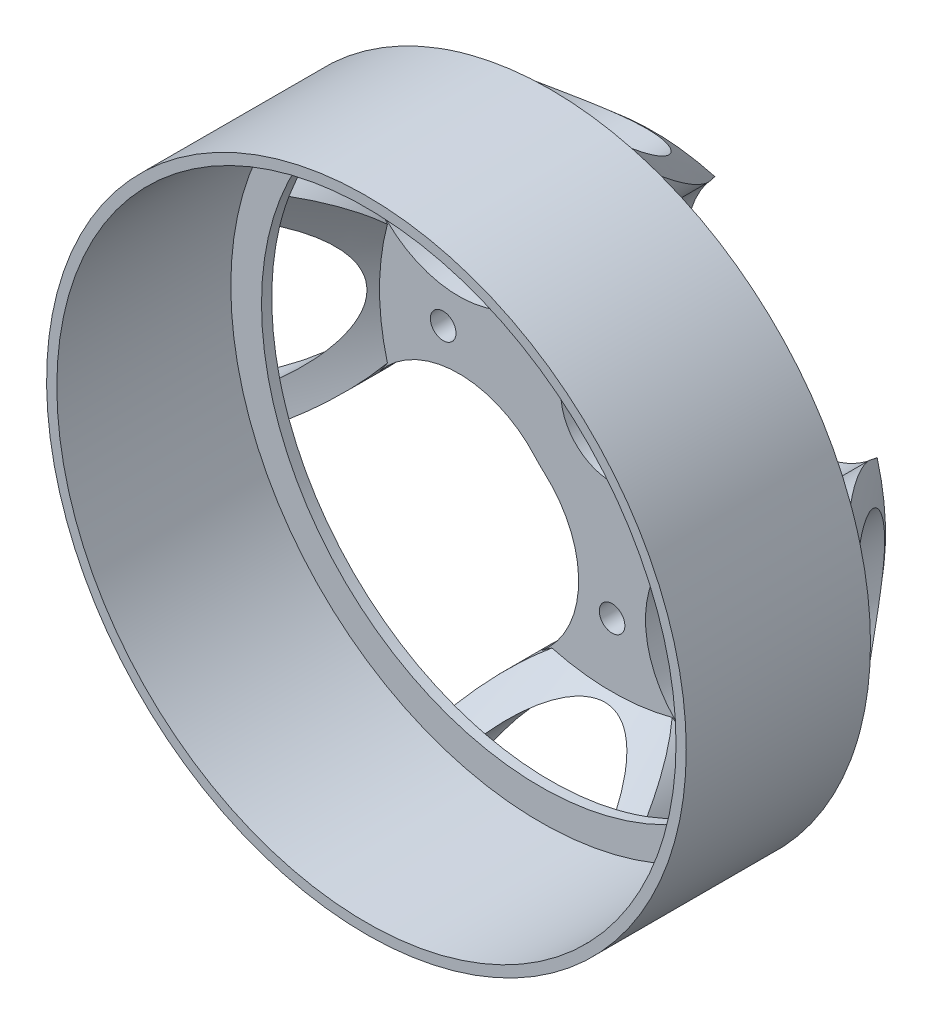
from build123d import *

# Parameters (mm, degrees)
SKETCH1_R             = 31.25
SKETCH1_R_2           = 30.25
BOSS_EXTRUDE1_DEPTH   = 17
BOSS_EXTRUDE2_START   = 1
SKETCH2_R             = 31.25
SKETCH2_R_2           = 27.25
BOSS_EXTRUDE2_DEPTH   = 1
SKETCH4_R             = 5
BOSS_EXTRUDE4_DEPTH   = 4
BOSS_EXTRUDE5_DEPTH   = 10
M3X0_5_TAPPED_HOLE1_D = 2.5


with BuildPart() as part:
    # Sketch1 → Boss-Extrude1 (new body)
    with BuildSketch(Plane.XY):
        Circle(SKETCH1_R)
        Circle(SKETCH1_R_2, mode=Mode.SUBTRACT)
    extrude(amount=BOSS_EXTRUDE1_DEPTH)

    # Sketch2 → Boss-Extrude2 (add)
    with BuildSketch(Plane(origin=(0, 0, 0), x_dir=(-1, 0, 0), z_dir=(0, 0, -1)).offset(BOSS_EXTRUDE2_START)):
        Circle(SKETCH2_R)
        Circle(SKETCH2_R_2, mode=Mode.SUBTRACT)
    extrude(amount=-BOSS_EXTRUDE2_DEPTH)



with BuildPart() as body_2:
    # Sketch4 → Boss-Extrude4 (new body)
    with BuildSketch(Plane(origin=(0, 0, -11), x_dir=(-1, 0, 0), z_dir=(0, 0, -1))):
        with BuildLine():
            ThreePointArc((6.631912224, -7.4845), (7.071067812, -7.071067812), (7.4845, -6.631912224))
            ThreePointArc((7.4845, -6.631912224), (15.176212796, -3.265971536), (22.721857143, -6.947717568))
            ThreePointArc((22.721857143, -6.947717568), (20.25, 0), (22.721857143, 6.947717568))
            ThreePointArc((22.721857143, 6.947717568), (15.176212796, 3.265971536), (7.4845, 6.631912224))
            ThreePointArc((7.4845, 6.631912224), (7.071067812, 7.071067812), (6.631912224, 7.4845))
            ThreePointArc((6.631912224, 7.4845), (3.265971536, 15.176212796), (6.947717568, 22.721857143))
            ThreePointArc((6.947717568, 22.721857143), (0, 20.25), (-6.947717568, 22.721857143))
            ThreePointArc((-6.947717568, 22.721857143), (-3.265971536, 15.176212796), (-6.631912224, 7.4845))
            ThreePointArc((-6.631912224, 7.4845), (-7.071067812, 7.071067812), (-7.4845, 6.631912224))
            ThreePointArc((-7.4845, 6.631912224), (-15.176212796, 3.265971536), (-22.721857143, 6.947717568))
            ThreePointArc((-22.721857143, 6.947717568), (-20.25, 0), (-22.721857143, -6.947717568))
            ThreePointArc((-22.721857143, -6.947717568), (-15.176212796, -3.265971536), (-7.4845, -6.631912224))
            ThreePointArc((-7.4845, -6.631912224), (-7.071067812, -7.071067812), (-6.631912224, -7.4845))
            ThreePointArc((-6.631912224, -7.4845), (-3.265971536, -15.176212796), (-6.947717568, -22.721857143))
            ThreePointArc((-6.947717568, -22.721857143), (0, -20.25), (6.947717568, -22.721857143))
            ThreePointArc((6.947717568, -22.721857143), (3.265971536, -15.176212796), (6.631912224, -7.4845))
        make_face()
        Circle(SKETCH4_R, mode=Mode.SUBTRACT)
    extrude(amount=-BOSS_EXTRUDE4_DEPTH)


with BuildPart() as part_1:
    add(part.part)

    add(body_2.part)  # Boss-Extrude5 merges body 2
    # Sketch4<10> → Boss-Extrude5 (add)
    with BuildSketch(Plane(origin=(0, 0, -11), x_dir=(-1, 0, 0), z_dir=(0, 0, -1))):
        with BuildLine():
            ThreePointArc((29.314, 10.828291832), (20.25, 0), (29.314, -10.828291832))
            ThreePointArc((29.314, -10.828291832), (29.805148071, -9.392318589), (30.226, -7.934193343))
            ThreePointArc((30.226, -7.934193343), (23.25, 0), (30.226, 7.934193343))
            ThreePointArc((30.226, 7.934193343), (29.805148071, 9.392318589), (29.314, 10.828291832))
        make_face()
        with BuildLine():
            ThreePointArc((-10.828291832, 29.314), (0, 20.25), (10.828291832, 29.314))
            ThreePointArc((10.828291832, 29.314), (9.392318589, 29.805148071), (7.934193343, 30.226))
            ThreePointArc((7.934193343, 30.226), (0, 23.25), (-7.934193343, 30.226))
            ThreePointArc((-7.934193343, 30.226), (-9.392318589, 29.805148071), (-10.828291832, 29.314))
        make_face()
        with BuildLine():
            ThreePointArc((10.828291832, -29.314), (0, -20.25), (-10.828291832, -29.314))
            ThreePointArc((-10.828291832, -29.314), (-9.392318589, -29.805148071), (-7.934193343, -30.226))
            ThreePointArc((-7.934193343, -30.226), (0, -23.25), (7.934193343, -30.226))
            ThreePointArc((7.934193343, -30.226), (9.392318589, -29.805148071), (10.828291832, -29.314))
        make_face()
        with BuildLine():
            ThreePointArc((-29.314, -10.828291832), (-20.25, 0), (-29.314, 10.828291832))
            ThreePointArc((-29.314, 10.828291832), (-29.805148071, 9.392318589), (-30.226, 7.934193343))
            ThreePointArc((-30.226, 7.934193343), (-23.25, 0), (-30.226, -7.934193343))
            ThreePointArc((-30.226, -7.934193343), (-29.805148071, -9.392318589), (-29.314, -10.828291832))
        make_face()
    extrude(amount=-BOSS_EXTRUDE5_DEPTH)

    # Sketch6 → Cut-Revolve3 (revolve, cut)
    with BuildSketch(Plane(origin=(0, 0, 0), x_dir=(0, 0, -1), z_dir=(1, 0, 0))):
        Polygon((1, 31.25), (11, 22.721857143), (11, 31.25), align=None)
        Polygon((1, 20.25), (7, 20.25), (7, 22.721857143), (1, 27.25), align=None)
    revolve(axis=Axis((0, 0, 0), (0, 0, -1)), mode=Mode.SUBTRACT)

    # M3x0.5 Tapped Hole1 (through all)
    with Locations(Plane(origin=(0, 16.5, -11), x_dir=(-1, 0, 0), z_dir=(0, 0, -1))):
        with Locations((0, 0), (-16.5, -16.5), (16.5, -16.5), (0, -33)):
            Hole(M3X0_5_TAPPED_HOLE1_D / 2)


solid = part_1.part
